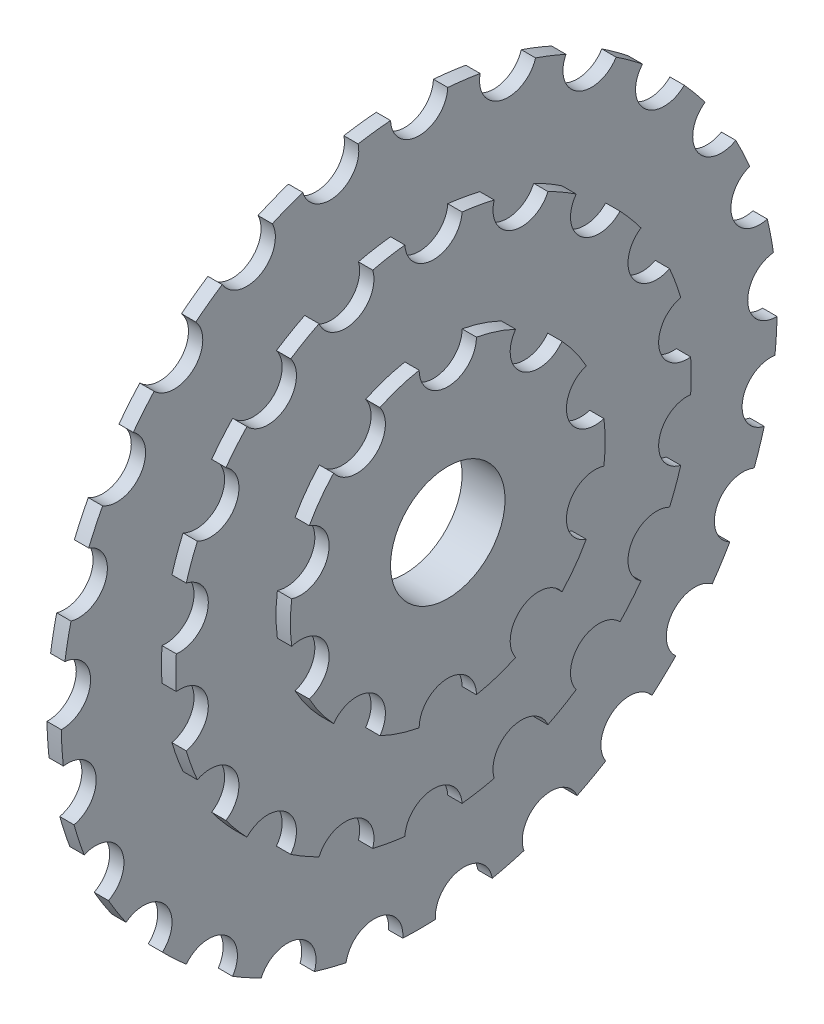
from build123d import *

# Parameters (mm, degrees)
BOSS_EXTRUDE1_DEPTH = 2.5
BOSS_EXTRUDE2_DEPTH = 2.5
BOSS_EXTRUDE3_DEPTH = 2.5
SKETCH6_R           = 10
CUT_EXTRUDE1_DEPTH  = 1128.535362564


with BuildPart() as part:
    # Sketch3 → Boss-Extrude1 (new body)
    with BuildSketch(Plane(origin=(0, 0, 0), x_dir=(0, 0, -1), z_dir=(1, 0, 0))):
        with BuildLine():
            ThreePointArc((-1068.282072039, 62.3), (-1071.119400738, 62.007168832), (-1073.940413688, 61.585185216))
            ThreePointArc((-1073.940413688, 61.585185216), (-1077.585742152, 55.693531765), (-1083.618493533, 59.10027666))
            ThreePointArc((-1083.618493533, 59.10027666), (-1086.293858183, 58.111030368), (-1088.921300766, 57.000746751))
            ThreePointArc((-1088.921300766, 57.000746751), (-1090.986909901, 50.387634103), (-1097.677354307, 52.187065582))
            ThreePointArc((-1097.677354307, 52.187065582), (-1100.022651908, 50.563562148), (-1102.291432244, 48.834741733))
            ThreePointArc((-1102.291432244, 48.834741733), (-1102.647532231, 41.915696077), (-1109.575284435, 41.994749243))
            ThreePointArc((-1109.575284435, 41.994749243), (-1111.443151314, 39.838999359), (-1113.210713589, 37.600270291))
            ThreePointArc((-1113.210713589, 37.600270291), (-1111.834929356, 30.810040711), (-1118.564693209, 29.163748363))
            ThreePointArc((-1118.564693209, 29.163748363), (-1119.837764419, 26.611205723), (-1120.993046196, 24.003235582))
            ThreePointArc((-1120.993046196, 24.003235582), (-1117.971823327, 17.768477177), (-1124.080743014, 14.500281917))
            ThreePointArc((-1124.080743014, 14.500281917), (-1124.679026811, 11.711332162), (-1125.149437486, 8.897989304))
            ThreePointArc((-1125.149437486, 8.897989304), (-1120.672610525, 3.610454873), (-1125.776840156, -1.07429057))
            ThreePointArc((-1125.776840156, -1.07429057), (-1125.662744167, -3.924407471), (-1125.418726108, -6.766350367))
            ThreePointArc((-1125.418726108, -6.766350367), (-1119.767590557, -10.774425589), (-1123.546412613, -16.58136143))
            ThreePointArc((-1123.546412613, -16.58136143), (-1122.727105909, -19.313562148), (-1121.783991668, -22.005535359))
            ThreePointArc((-1121.783991668, -22.005535359), (-1115.313629157, -24.482309265), (-1117.52960635, -31.04656437))
            ThreePointArc((-1117.52960635, -31.04656437), (-1116.056568984, -33.489174686), (-1114.473617897, -35.862031634))
            ThreePointArc((-1114.473617897, -35.862031634), (-1107.5905851, -36.651879411), (-1108.104479433, -43.560997488))
            ThreePointArc((-1108.104479433, -43.560997488), (-1106.070267761, -45.560539214), (-1103.946942466, -47.46518457))
            ThreePointArc((-1103.946942466, -47.46518457), (-1097.083725647, -46.518477177), (-1095.86324725, -53.338332929))
            ThreePointArc((-1095.86324725, -53.338332929), (-1093.395678271, -54.769167503), (-1090.865395107, -56.085925395))
            ThreePointArc((-1090.865395107, -56.085925395), (-1084.453235419, -53.462147939), (-1081.575071438, -59.764224747))
            ThreePointArc((-1081.575071438, -59.764224747), (-1078.829191588, -60.536447571), (-1076.05093755, -61.182581258))
            ThreePointArc((-1076.05093755, -61.182581258), (-1070.49273457, -57.046595326), (-1066.137730632, -62.434910526))
            ThreePointArc((-1066.137730632, -62.434910526), (-1063.28607364, -62.5), (-1060.434416648, -62.434910526))
            ThreePointArc((-1060.434416648, -62.434910526), (-1056.07941271, -57.046595326), (-1050.52120973, -61.182581258))
            ThreePointArc((-1050.52120973, -61.182581258), (-1047.742955692, -60.536447571), (-1044.997075843, -59.764224747))
            ThreePointArc((-1044.997075843, -59.764224747), (-1042.118911861, -53.462147939), (-1035.706752173, -56.085925395))
            ThreePointArc((-1035.706752173, -56.085925395), (-1033.176469009, -54.769167503), (-1030.708900031, -53.338332929))
            ThreePointArc((-1030.708900031, -53.338332929), (-1029.488421633, -46.518477177), (-1022.625204814, -47.46518457))
            ThreePointArc((-1022.625204814, -47.46518457), (-1020.50187952, -45.560539214), (-1018.467667847, -43.560997488))
            ThreePointArc((-1018.467667847, -43.560997488), (-1018.981562181, -36.651879411), (-1012.098529383, -35.862031634))
            ThreePointArc((-1012.098529383, -35.862031634), (-1010.515578296, -33.489174686), (-1009.04254093, -31.04656437))
            ThreePointArc((-1009.04254093, -31.04656437), (-1011.258518123, -24.482309265), (-1004.788155613, -22.005535359))
            ThreePointArc((-1004.788155613, -22.005535359), (-1003.845041372, -19.313562148), (-1003.025734667, -16.58136143))
            ThreePointArc((-1003.025734667, -16.58136143), (-1006.804556723, -10.774425589), (-1001.153421172, -6.766350367))
            ThreePointArc((-1001.153421172, -6.766350367), (-1000.909403113, -3.924407471), (-1000.795307124, -1.07429057))
            ThreePointArc((-1000.795307124, -1.07429057), (-1005.899536756, 3.610454873), (-1001.422709794, 8.897989304))
            ThreePointArc((-1001.422709794, 8.897989304), (-1001.89312047, 11.711332162), (-1002.491404266, 14.500281917))
            ThreePointArc((-1002.491404266, 14.500281917), (-1008.600323953, 17.768477177), (-1005.579101084, 24.003235582))
            ThreePointArc((-1005.579101084, 24.003235582), (-1006.734382861, 26.611205723), (-1008.007454072, 29.163748363))
            ThreePointArc((-1008.007454072, 29.163748363), (-1014.737217924, 30.810040711), (-1013.361433691, 37.600270291))
            ThreePointArc((-1013.361433691, 37.600270291), (-1015.128995967, 39.838999359), (-1016.996862845, 41.994749243))
            ThreePointArc((-1016.996862845, 41.994749243), (-1023.924615049, 41.915696077), (-1024.280715036, 48.834741733))
            ThreePointArc((-1024.280715036, 48.834741733), (-1026.549495372, 50.563562148), (-1028.894792973, 52.187065582))
            ThreePointArc((-1028.894792973, 52.187065582), (-1035.585237379, 50.387634103), (-1037.650846514, 57.000746751))
            ThreePointArc((-1037.650846514, 57.000746751), (-1040.278289097, 58.111030368), (-1042.953653748, 59.10027666))
            ThreePointArc((-1042.953653748, 59.10027666), (-1048.986405128, 55.693531765), (-1052.631733592, 61.585185216))
            ThreePointArc((-1052.631733592, 61.585185216), (-1055.452746542, 62.007168832), (-1058.290075241, 62.3))
            ThreePointArc((-1058.290075241, 62.3), (-1063.28607364, 57.5), (-1068.282072039, 62.3))
        make_face()
    extrude(amount=BOSS_EXTRUDE1_DEPTH)

    # Sketch4 → Boss-Extrude2 (add)
    with BuildSketch(Plane(origin=(2.5, 0, 0), x_dir=(0, 0, -1), z_dir=(1, 0, 0))):
        with BuildLine():
            ThreePointArc((-1068.278351628, 44.722222222), (-1071.100241635, 44.316348886), (-1073.890767708, 43.73260184))
            ThreePointArc((-1073.890767708, 43.73260184), (-1076.966879373, 37.587704831), (-1083.27318128, 40.317682575))
            ThreePointArc((-1083.27318128, 40.317682575), (-1085.78607364, 38.97114317), (-1088.208657151, 37.468184252))
            ThreePointArc((-1088.208657151, 37.468184252), (-1088.997578028, 30.641777725), (-1095.857270773, 31.050235383))
            ThreePointArc((-1095.857270773, 31.050235383), (-1097.75807358, 28.925442436), (-1099.520515204, 26.684550671))
            ThreePointArc((-1099.520515204, 26.684550671), (-1097.927089791, 20), (-1104.512793192, 18.037671551))
            ThreePointArc((-1104.512793192, 18.037671551), (-1105.572241575, 15.39090645), (-1106.461964842, 12.682366458))
            ThreePointArc((-1106.461964842, 12.682366458), (-1102.678383761, 6.945927107), (-1108.195764791, 2.849498323))
            ThreePointArc((-1108.195764791, 2.849498323), (-1108.28607364, 0), (-1108.195764791, -2.849498323))
            ThreePointArc((-1108.195764791, -2.849498323), (-1102.678383761, -6.945927107), (-1106.461964842, -12.682366458))
            ThreePointArc((-1106.461964842, -12.682366458), (-1105.572241575, -15.39090645), (-1104.512793192, -18.037671551))
            ThreePointArc((-1104.512793192, -18.037671551), (-1097.927089791, -20), (-1099.520515204, -26.684550671))
            ThreePointArc((-1099.520515204, -26.684550671), (-1097.75807358, -28.925442436), (-1095.857270773, -31.050235383))
            ThreePointArc((-1095.857270773, -31.050235383), (-1088.997578028, -30.641777725), (-1088.208657151, -37.468184252))
            ThreePointArc((-1088.208657151, -37.468184252), (-1085.78607364, -38.97114317), (-1083.27318128, -40.317682575))
            ThreePointArc((-1083.27318128, -40.317682575), (-1076.966879373, -37.587704831), (-1073.890767708, -43.73260184))
            ThreePointArc((-1073.890767708, -43.73260184), (-1071.100241635, -44.316348886), (-1068.278351628, -44.722222222))
            ThreePointArc((-1068.278351628, -44.722222222), (-1063.28607364, -40), (-1058.293795652, -44.722222222))
            ThreePointArc((-1058.293795652, -44.722222222), (-1055.471905645, -44.316348886), (-1052.681379572, -43.73260184))
            ThreePointArc((-1052.681379572, -43.73260184), (-1049.605267907, -37.587704831), (-1043.298966, -40.317682575))
            ThreePointArc((-1043.298966, -40.317682575), (-1040.78607364, -38.97114317), (-1038.363490129, -37.468184252))
            ThreePointArc((-1038.363490129, -37.468184252), (-1037.574569253, -30.641777725), (-1030.714876507, -31.050235383))
            ThreePointArc((-1030.714876507, -31.050235383), (-1028.8140737, -28.925442436), (-1027.051632076, -26.684550671))
            ThreePointArc((-1027.051632076, -26.684550671), (-1028.645057489, -20), (-1022.059354088, -18.037671551))
            ThreePointArc((-1022.059354088, -18.037671551), (-1020.999905705, -15.39090645), (-1020.110182439, -12.682366458))
            ThreePointArc((-1020.110182439, -12.682366458), (-1023.89376352, -6.945927107), (-1018.376382489, -2.849498323))
            ThreePointArc((-1018.376382489, -2.849498323), (-1018.28607364, 0), (-1018.376382489, 2.849498323))
            ThreePointArc((-1018.376382489, 2.849498323), (-1023.89376352, 6.945927107), (-1020.110182439, 12.682366458))
            ThreePointArc((-1020.110182439, 12.682366458), (-1020.999905705, 15.39090645), (-1022.059354088, 18.037671551))
            ThreePointArc((-1022.059354088, 18.037671551), (-1028.645057489, 20), (-1027.051632076, 26.684550671))
            ThreePointArc((-1027.051632076, 26.684550671), (-1028.8140737, 28.925442436), (-1030.714876507, 31.050235383))
            ThreePointArc((-1030.714876507, 31.050235383), (-1037.574569253, 30.641777725), (-1038.363490129, 37.468184252))
            ThreePointArc((-1038.363490129, 37.468184252), (-1040.78607364, 38.97114317), (-1043.298966, 40.317682575))
            ThreePointArc((-1043.298966, 40.317682575), (-1049.605267907, 37.587704831), (-1052.681379572, 43.73260184))
            ThreePointArc((-1052.681379572, 43.73260184), (-1055.471905645, 44.316348886), (-1058.293795652, 44.722222222))
            ThreePointArc((-1058.293795652, 44.722222222), (-1063.28607364, 40), (-1068.278351628, 44.722222222))
        make_face()
    extrude(amount=BOSS_EXTRUDE2_DEPTH)

    # Sketch5 → Boss-Extrude3 (add)
    with BuildSketch(Plane(origin=(5, 0, 0), x_dir=(0, 0, -1), z_dir=(1, 0, 0))):
        with BuildLine():
            ThreePointArc((-1068.28607364, 27.041634566), (-1071.784040985, 26.154054198), (-1075.135662664, 24.816068181))
            ThreePointArc((-1075.135662664, 24.816068181), (-1076.241821374, 17.832056948), (-1083.225832608, 18.938215658))
            ThreePointArc((-1083.225832608, 18.938215658), (-1085.534040985, 16.164094438), (-1087.459111433, 13.111607218))
            ThreePointArc((-1087.459111433, 13.111607218), (-1084.248913824, 6.811239665), (-1090.549281377, 3.601042055))
            ThreePointArc((-1090.549281377, 3.601042055), (-1090.78607364, 0), (-1090.549281377, -3.601042055))
            ThreePointArc((-1090.549281377, -3.601042055), (-1084.248913824, -6.811239665), (-1087.459111433, -13.111607218))
            ThreePointArc((-1087.459111433, -13.111607218), (-1085.534040985, -16.164094438), (-1083.225832608, -18.938215658))
            ThreePointArc((-1083.225832608, -18.938215658), (-1076.241821374, -17.832056948), (-1075.135662664, -24.816068181))
            ThreePointArc((-1075.135662664, -24.816068181), (-1071.784040985, -26.154054198), (-1068.28607364, -27.041634566))
            ThreePointArc((-1068.28607364, -27.041634566), (-1063.28607364, -22.041634566), (-1058.28607364, -27.041634566))
            ThreePointArc((-1058.28607364, -27.041634566), (-1054.788106295, -26.154054198), (-1051.436484616, -24.816068181))
            ThreePointArc((-1051.436484616, -24.816068181), (-1050.330325906, -17.832056948), (-1043.346314672, -18.938215658))
            ThreePointArc((-1043.346314672, -18.938215658), (-1041.038106295, -16.164094438), (-1039.113035847, -13.111607218))
            ThreePointArc((-1039.113035847, -13.111607218), (-1042.323233456, -6.811239665), (-1036.022865903, -3.601042055))
            ThreePointArc((-1036.022865903, -3.601042055), (-1035.78607364, 0), (-1036.022865903, 3.601042055))
            ThreePointArc((-1036.022865903, 3.601042055), (-1042.323233456, 6.811239665), (-1039.113035847, 13.111607218))
            ThreePointArc((-1039.113035847, 13.111607218), (-1041.038106295, 16.164094438), (-1043.346314672, 18.938215658))
            ThreePointArc((-1043.346314672, 18.938215658), (-1050.330325906, 17.832056948), (-1051.436484616, 24.816068181))
            ThreePointArc((-1051.436484616, 24.816068181), (-1054.788106295, 26.154054198), (-1058.28607364, 27.041634566))
            ThreePointArc((-1058.28607364, 27.041634566), (-1063.28607364, 22.041634566), (-1068.28607364, 27.041634566))
        make_face()
    extrude(amount=BOSS_EXTRUDE3_DEPTH)

    # Sketch6 → Cut-Extrude1 (cut, through all)
    with BuildSketch(Plane(origin=(0, 0, 0), x_dir=(0, 0, -1), z_dir=(1, 0, 0))):
        with Locations((-1063.28607364, 0)):
            Circle(SKETCH6_R)
    extrude(amount=CUT_EXTRUDE1_DEPTH, mode=Mode.SUBTRACT)


solid = part.part
